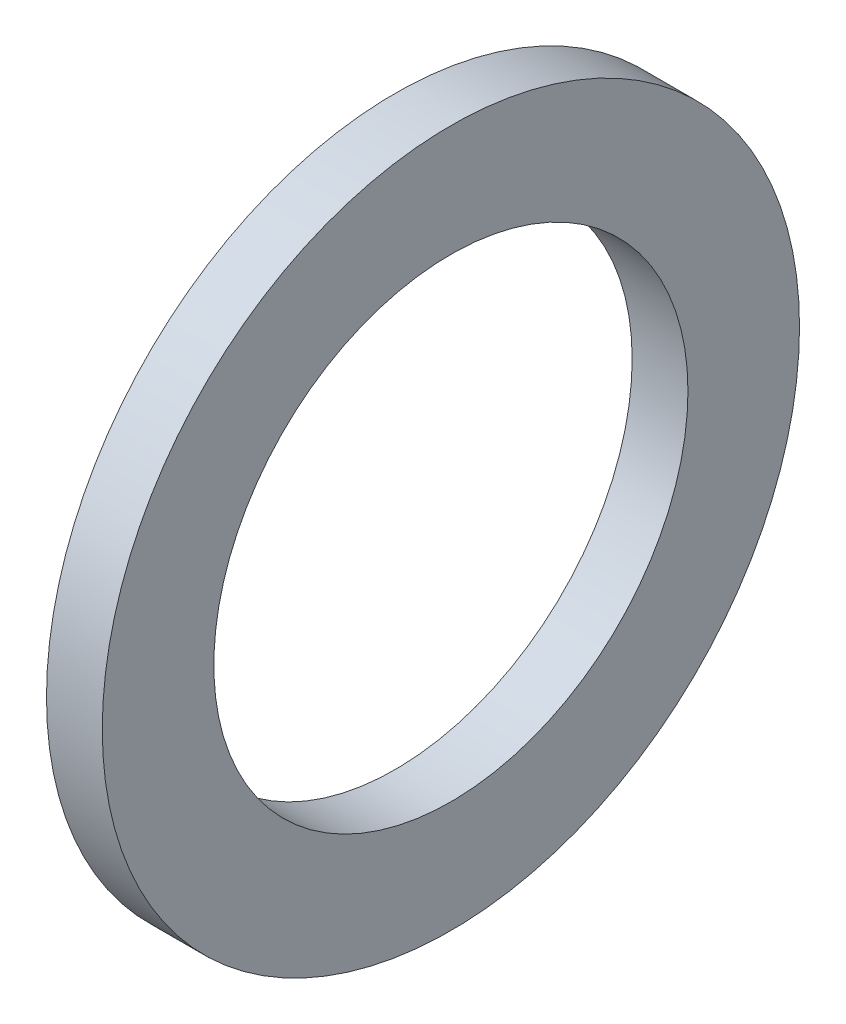
from build123d import *

# Parameters (mm, degrees)
SKETCH_1_W = 2
SKETCH_1_H = 4


with BuildPart() as part:
    # 草图1 → 旋转1 (revolve)
    with BuildSketch(Plane.XY, mode=Mode.PRIVATE) as revolve_1_sk:
        with Locations((1, 10.5)):
            Rectangle(SKETCH_1_W, SKETCH_1_H)
    revolve(revolve_1_sk.sketch.rotate(Axis((0, 0, 0), (-1, 0, 0)), 90), axis=Axis((0, 0, 0), (-1, 0, 0)))


solid = part.part
